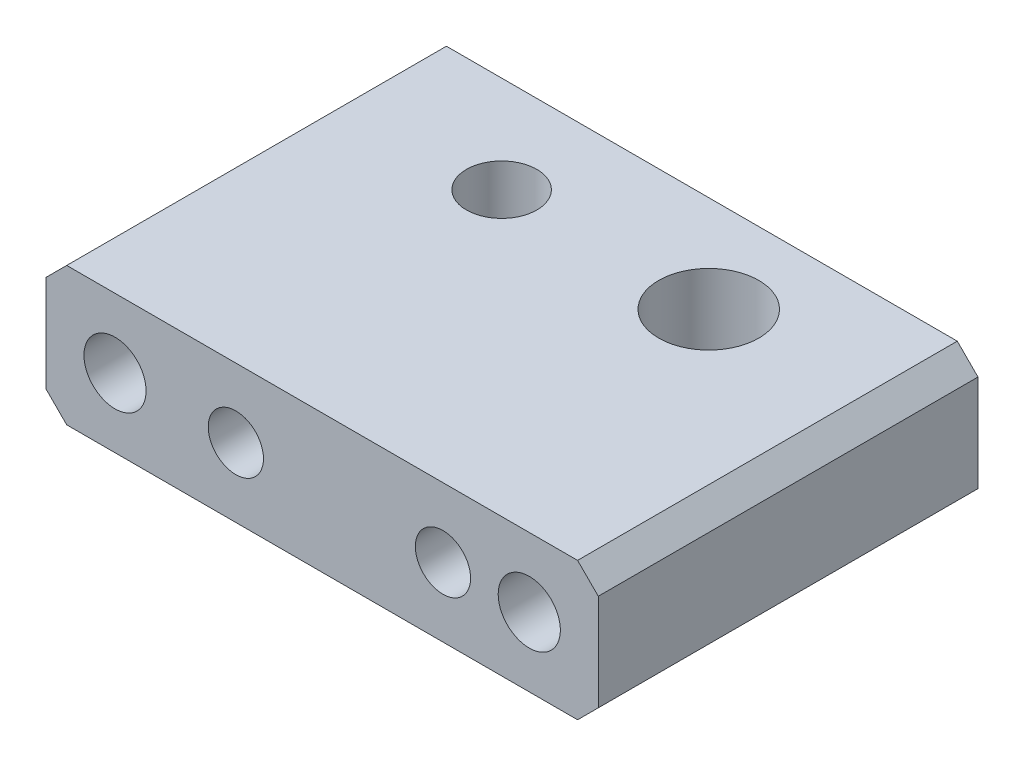
from build123d import *

# Parameters (mm, degrees)
SKETCH1_W                                           = 80
SKETCH1_H                                           = 55
BOSS_EXTRUDE1_DEPTH                                 = 10
M12_TAPPED_HOLE1_D                                  = 10.2
M16X1_5_TAPPED_HOLE1_D                              = 14.5
CBORE_FOR_M8_HEX_SOCKET_HEAD_CAP_SCREW2_D           = 9
CBORE_FOR_M8_HEX_SOCKET_HEAD_CAP_SCREW2_CBORE_D     = 14
CBORE_FOR_M8_HEX_SOCKET_HEAD_CAP_SCREW2_CBORE_DEPTH = 30
F_8_0_8_DIAMETER_HOLE1_D                            = 8
F_8_0_8_DIAMETER_HOLE1_DEPTH                        = 30
F_8_0_8_DIAMETER_HOLE1_TIP                          = 2.403442476
CHAMFER1_SIZE                                       = 3


with BuildPart() as part:
    # Sketch1 → Boss-Extrude1 (new, symmetric)
    with BuildSketch(Plane(origin=(0, 0, 0), x_dir=(1, 0, 0), z_dir=(0, 1, 0))):
        with Locations((40, 27.5)):
            Rectangle(SKETCH1_W, SKETCH1_H)
    extrude(amount=BOSS_EXTRUDE1_DEPTH, both=True)

    # M12 Tapped Hole1 (through all)
    with Locations(Plane(origin=(0, 10, 0), x_dir=(1, 0, 0), z_dir=(0, 1, 0))):
        with Locations((25, 41)):
            Hole(M12_TAPPED_HOLE1_D / 2)

    # M16x1.5 Tapped Hole1 (through all)
    with Locations(Plane(origin=(0, 10, 0), x_dir=(1, 0, 0), z_dir=(0, 1, 0))):
        with Locations((55, 41)):
            Hole(M16X1_5_TAPPED_HOLE1_D / 2)

    # CBORE for M8 Hex Socket Head Cap Screw2 (through all)
    with Locations(Plane(origin=(0, 0, -55), x_dir=(-1, 0, 0), z_dir=(0, 0, -1))):
        with Locations((-70, 0), (-10, 0)):
            CounterBoreHole(CBORE_FOR_M8_HEX_SOCKET_HEAD_CAP_SCREW2_D / 2, CBORE_FOR_M8_HEX_SOCKET_HEAD_CAP_SCREW2_CBORE_D / 2, CBORE_FOR_M8_HEX_SOCKET_HEAD_CAP_SCREW2_CBORE_DEPTH)

    # Ø8.0 (8) Diameter Hole1
    with Locations(Plane.XY):
        with Locations((27.5, 0), (57.5, 0)):
            Hole(F_8_0_8_DIAMETER_HOLE1_D / 2, depth=F_8_0_8_DIAMETER_HOLE1_DEPTH)
            with Locations((0, 0, -(F_8_0_8_DIAMETER_HOLE1_DEPTH + F_8_0_8_DIAMETER_HOLE1_TIP / 2))):  # 118° drill point
                Cone(0, F_8_0_8_DIAMETER_HOLE1_D / 2, F_8_0_8_DIAMETER_HOLE1_TIP, mode=Mode.SUBTRACT)

    # Chamfer1
    chamfer1_edges = [part.edges().sort_by_distance(p)[0] for p in [
        (80, 10, -27.5),
        (0, 10, -27.5),
        (80, -10, -27.5),
        (0, -10, -27.5),
    ]]
    chamfer(chamfer1_edges, length=CHAMFER1_SIZE)


solid = part.part
